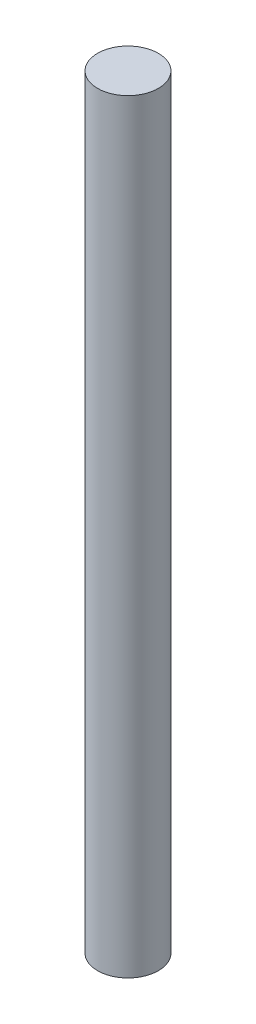
from build123d import *

# Parameters (mm, degrees)
SKETCH_2_R      = 1.99
EXTRUDE_3_DEPTH = 50


with BuildPart() as part:
    # 草图2 → 凸台-拉伸3 (new body)
    with BuildSketch(Plane(origin=(0, 0, 0), x_dir=(1, 0, 0), z_dir=(0, 1, 0))):
        with Locations(Location((0, 0, 0), (0, 0, 270))):
            Circle(SKETCH_2_R)
    extrude(amount=EXTRUDE_3_DEPTH)


solid = part.part
